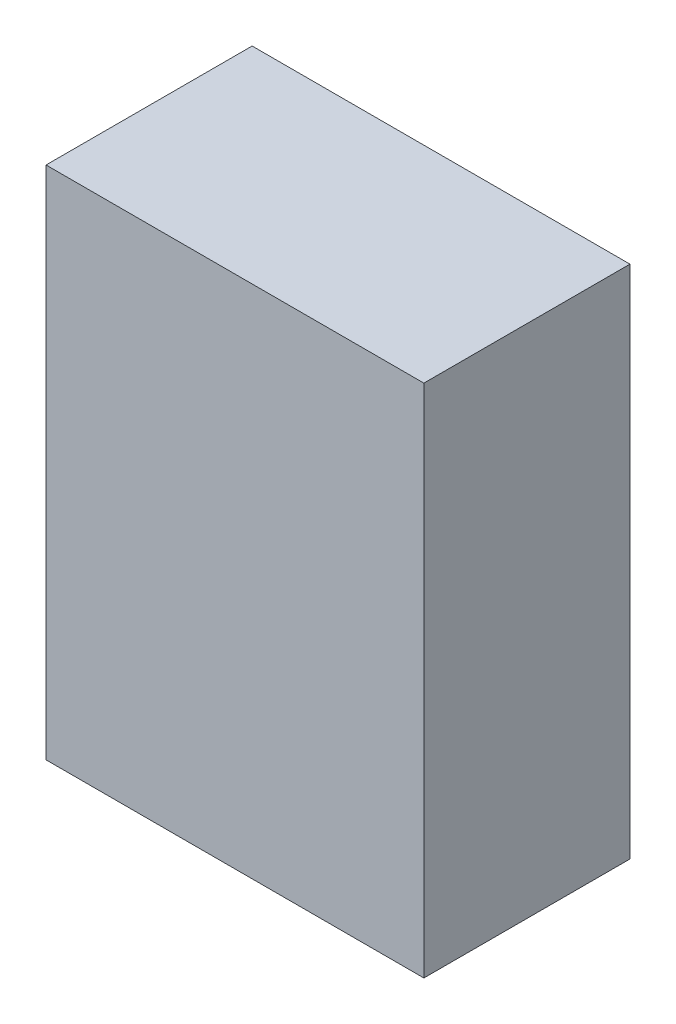
from build123d import *

# Parameters (mm, degrees)
SKETCH1_W           = 22
SKETCH1_H           = 12
BOSS_EXTRUDE1_DEPTH = 30


with BuildPart() as part:
    # Sketch1 → Boss-Extrude1 (new body)
    with BuildSketch(Plane(origin=(0, 0, 0), x_dir=(1, 0, 0), z_dir=(0, 1, 0))):
        with Locations((11, 6)):
            Rectangle(SKETCH1_W, SKETCH1_H)
    extrude(amount=BOSS_EXTRUDE1_DEPTH)


solid = part.part
